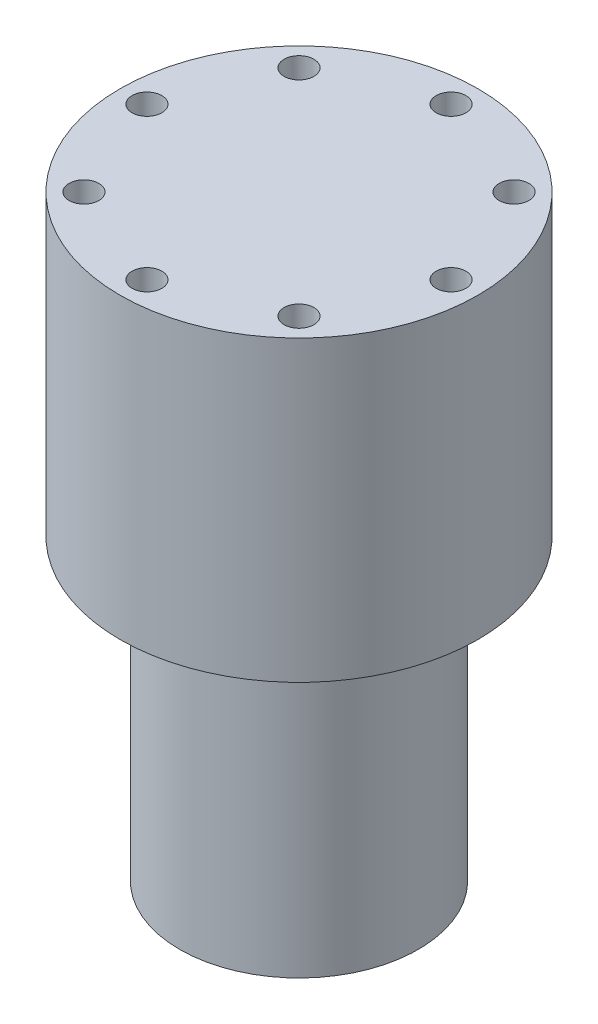
from build123d import *

# Parameters (mm, degrees)
SKETCH1_R           = 25.4
BOSS_EXTRUDE1_DEPTH = 63.5
SKETCH2_R           = 38.1
BOSS_EXTRUDE2_DEPTH = 63.5
SKETCH3_R           = 3.175
CUT_EXTRUDE1_DEPTH  = 25.4
CIRPATTERN1_COUNT   = 8


with BuildPart() as part:
    # Sketch1 → Boss-Extrude1 (new body)
    with BuildSketch(Plane(origin=(0, 0, 0), x_dir=(1, 0, 0), z_dir=(0, 1, 0))):
        with Locations(Location((0, 0, 0), (0, 0, 270))):
            Circle(SKETCH1_R)
    extrude(amount=BOSS_EXTRUDE1_DEPTH)

    # Sketch2 → Boss-Extrude2 (add)
    with BuildSketch(Plane(origin=(0, 63.5, 0), x_dir=(1, 0, 0), z_dir=(0, 1, 0))):
        with Locations(Location((0, 0, 0), (0, 0, 270))):
            Circle(SKETCH2_R)
    extrude(amount=BOSS_EXTRUDE2_DEPTH)

    # Sketch3 → Cut-Extrude1 (cut)
    with BuildSketch(Plane(origin=(0, 127, 0), x_dir=(1, 0, 0), z_dir=(0, 1, 0))):
        with Locations(Location((0, 32.377227974, 0), (0, 0, 270))):
            Circle(SKETCH3_R)
    cut_extrude1 = extrude(amount=-CUT_EXTRUDE1_DEPTH, mode=Mode.SUBTRACT)

    # CirPattern1: Cut-Extrude1 ×8 about axis
    cirpattern1_axis = Axis((0, 0, 0), (0, 1, 0))
    for i in range(1, CIRPATTERN1_COUNT):
        add(cut_extrude1.rotate(cirpattern1_axis, i * 360 / CIRPATTERN1_COUNT), mode=Mode.SUBTRACT)


solid = part.part
